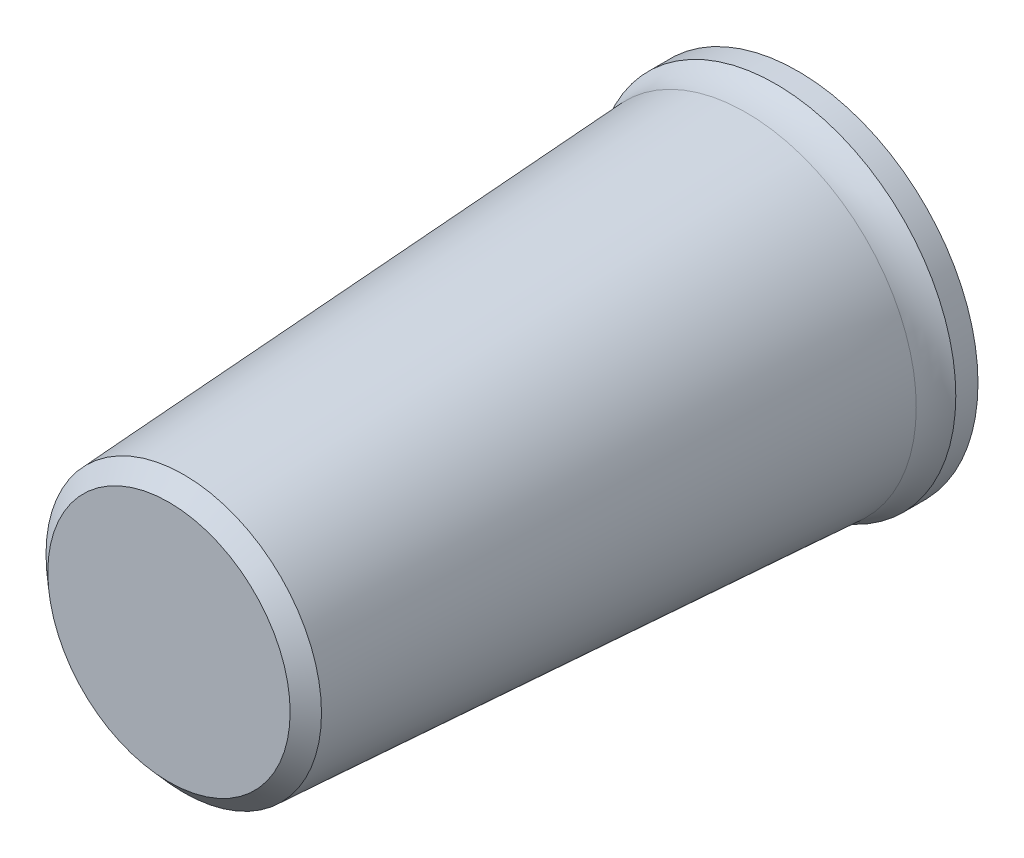
from build123d import *

# Parameters (mm, degrees)
CHAMFER1_SIZE  = 0.2
CHAMFER1_SIZE2 = 0.212590053


with BuildPart() as part:
    # Sketch1 → Revolve1 (revolve)
    with BuildSketch(Plane(origin=(0, 0, 0), x_dir=(0, 0, -1), z_dir=(1, 0, 0))):
        with BuildLine():
            Line((-8.5, 0), (-0.7, 0))
            Line((-0.7, 0), (0, 0))
            Line((0, 0), (0, 2.434566302))
            Line((0, 2.434566302), (-0.3, 2.434566302))
            ThreePointArc((-0.3, 2.434566302), (-0.490966479, 2.340430897), (-0.7, 2.3))
            Line((-0.7, 2.3), (-8.5, 1.85025483))
            Line((-8.5, 1.85025483), (-8.5, 0))
        make_face()
    revolve(axis=Axis((0, 0, 14.033730871), (0, 0, -1)))

    # Chamfer1
    chamfer1_edges = [part.edges().sort_by_distance(p)[0] for p in [
        (0, -1.85025483, 8.5),
    ]]
    chamfer1_side = [part.faces().sort_by_distance(p)[0] for p in [
        (0, -2.075127415, 4.6),
    ]]
    chamfer(chamfer1_edges, length=CHAMFER1_SIZE, length2=CHAMFER1_SIZE2, reference=chamfer1_side[0])


solid = part.part
